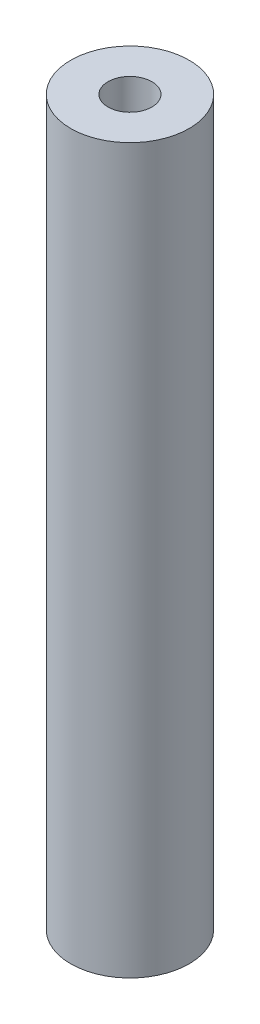
from build123d import *

# Parameters (mm, degrees)
SKETCH1_R           = 5.715
SKETCH1_R_2         = 2.1209
BOSS_EXTRUDE1_DEPTH = 69.8246


with BuildPart() as part:
    # Sketch1 → Boss-Extrude1 (new body)
    with BuildSketch(Plane(origin=(0, 0, 0), x_dir=(1, 0, 0), z_dir=(0, 1, 0))):
        with Locations(Location((0, 0, 0), (0, 0, 270))):
            Circle(SKETCH1_R)
        with Locations(Location((0, 0, 0), (0, 0, 270))):
            Circle(SKETCH1_R_2, mode=Mode.SUBTRACT)
    extrude(amount=BOSS_EXTRUDE1_DEPTH)


solid = part.part
